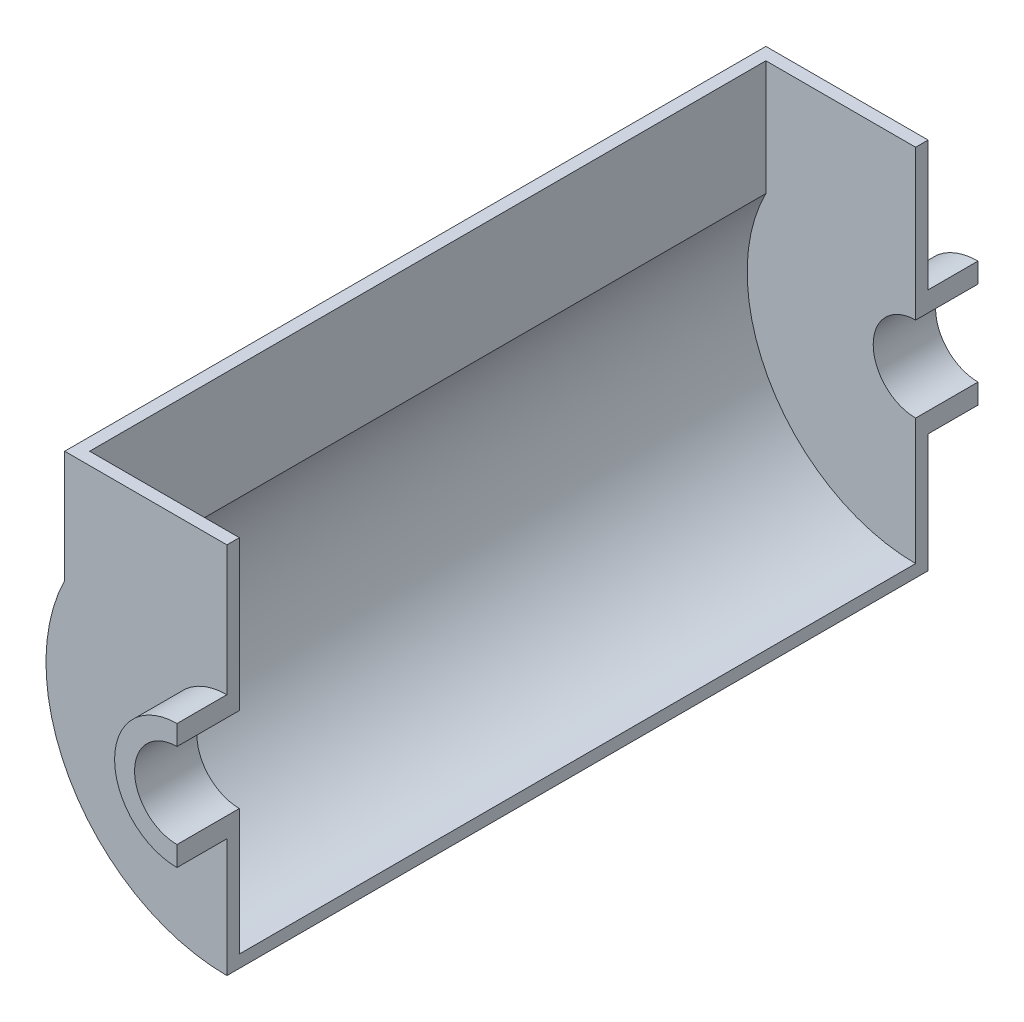
from build123d import *

# Parameters (mm, degrees)
BOSS_EXTRUDE1_DEPTH      = 20
BOSS_EXTRUDE1_DEPTH_BACK = 5
BOSS_EXTRUDE2_START      = -5
BOSS_EXTRUDE2_DEPTH      = 5
BOSS_EXTRUDE3_REACH      = 316.327


with BuildPart() as part:
    # Sketch1 → Boss-Extrude1 (new, two sides: drawn at the far end of the back side and taken through both)
    with BuildSketch(Plane.XY.offset(-BOSS_EXTRUDE1_DEPTH_BACK)):
        with BuildLine():
            Line((0, 25), (0, 17))
            ThreePointArc((0, 17), (-17, 0), (0, -17))
            Line((0, -17), (0, -25))
            ThreePointArc((0, -25), (-25, 0), (0, 25))
        make_face()
    extrude(amount=BOSS_EXTRUDE1_DEPTH + BOSS_EXTRUDE1_DEPTH_BACK)

    # Sketch2 → Boss-Extrude2 (add)
    with BuildSketch(Plane.XY.offset(BOSS_EXTRUDE2_START)):
        with BuildLine():
            Line((0, 25), (0, 77))
            Line((0, 77), (-65, 77))
            Line((-65, 77), (-65, 32.113081447))
            ThreePointArc((-65, 32.113081447), (-61.581037686, -38.262590053), (0, -72.5))
            Line((0, -72.5), (0, -25))
            ThreePointArc((0, -25), (-25, 0), (0, 25))
        make_face()
    extrude(amount=BOSS_EXTRUDE2_DEPTH)


with BuildPart() as body_2:
    # Mirror13: mirrored copy
    add(part.part.mirror(Plane.XY.offset(-140.5)))

    # Sketch3 → Boss-Extrude3 (add, up to next)
    with BuildSketch(Plane(origin=(0, 0, -5), x_dir=(-1, 0, 0), z_dir=(0, 0, -1)), mode=Mode.PRIVATE) as boss_extrude3_sk1:
        with BuildLine():
            Line((65, 77), (65, 32.113081447))
            ThreePointArc((65, 32.113081447), (61.581037686, -38.262590053), (0, -72.5))
            Line((0, -72.5), (0, -67.5))
            ThreePointArc((0, -67.5), (57.634938288, -35.134938288), (60, 30.923292192))
            Line((60, 30.923292192), (60, 77))
            Line((60, 77), (65, 77))
        make_face()
    boss_extrude3_tool1 = extrude(boss_extrude3_sk1.sketch, amount=BOSS_EXTRUDE3_REACH, mode=Mode.PRIVATE) - body_2.part

    add(part.part)  # Boss-Extrude3 merges part
    add(boss_extrude3_tool1.solids().sort_by_distance((-61.66152, 53.961646, -5))[0])


solid = body_2.part
